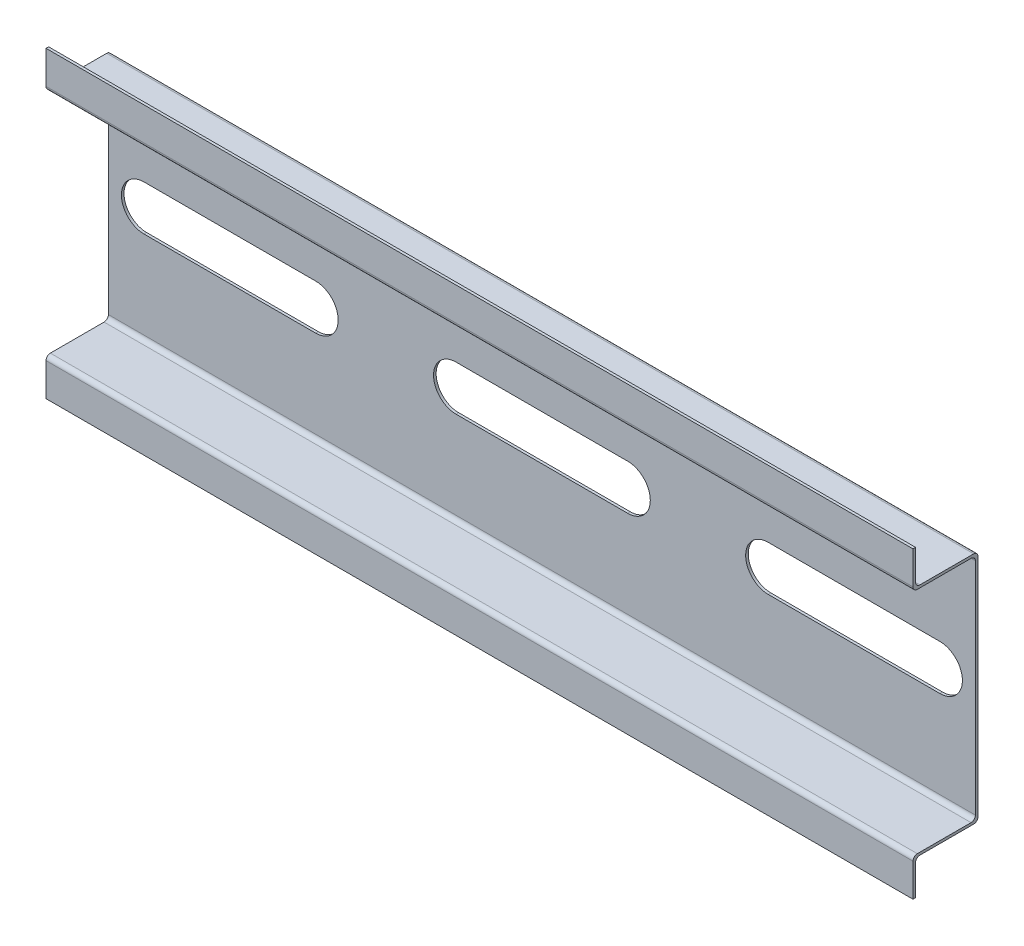
from build123d import *

# Parameters (mm, degrees)
AUFSATZ_LINEAR_AUSTRAGEN1_DEPTH = 100
SCHNITT_LINEAR_AUSTRAGEN1_DEPTH = 102.796365358


with BuildPart() as part:
    # Skizze1 → Aufsatz-Linear austragen1 (new body)
    with BuildSketch(Plane(origin=(0, 0, 0), x_dir=(0, 0, -1), z_dir=(1, 0, 0))):
        with BuildLine():
            Line((-3.75, 17.5), (-3.75, 13.7))
            ThreePointArc((-3.75, 13.7), (-3.603553391, 13.346446609), (-3.25, 13.2))
            Line((-3.25, 13.2), (2.95, 13.2))
            ThreePointArc((2.95, 13.2), (3.303553391, 13.053553391), (3.45, 12.7))
            Line((3.45, 12.7), (3.45, -12.7))
            ThreePointArc((3.45, -12.7), (3.303553391, -13.053553391), (2.95, -13.2))
            Line((2.95, -13.2), (-3.25, -13.2))
            ThreePointArc((-3.25, -13.2), (-3.603553391, -13.346446609), (-3.75, -13.7))
            Line((-3.75, -13.7), (-3.75, -17.5))
            Line((-3.75, -17.5), (-3.45, -17.5))
            Line((-3.45, -17.5), (-3.45, -14))
            ThreePointArc((-3.45, -14), (-3.303553391, -13.646446609), (-2.95, -13.5))
            Line((-2.95, -13.5), (3.25, -13.5))
            ThreePointArc((3.25, -13.5), (3.603553391, -13.353553391), (3.75, -13))
            Line((3.75, -13), (3.75, 13))
            ThreePointArc((3.75, 13), (3.603553391, 13.353553391), (3.25, 13.5))
            Line((3.25, 13.5), (-2.95, 13.5))
            ThreePointArc((-2.95, 13.5), (-3.303553391, 13.646446609), (-3.45, 14))
            Line((-3.45, 14), (-3.45, 17.5))
            Line((-3.45, 17.5), (-3.75, 17.5))
        make_face()
    extrude(amount=AUFSATZ_LINEAR_AUSTRAGEN1_DEPTH)

    # Skizze2 → Schnitt-Linear austragen1 (cut, through all)
    with BuildSketch(Plane(origin=(0, 0, -3.75), x_dir=(-1, 0, 0), z_dir=(0, 0, -1))):
        with BuildLine():
            Line((-95.9, 2.6), (-76.1, 2.6))
            ThreePointArc((-76.1, 2.6), (-73.5, 0), (-76.1, -2.6))
            Line((-76.1, -2.6), (-95.9, -2.6))
            ThreePointArc((-95.9, -2.6), (-98.5, 0), (-95.9, 2.6))
        make_face()
        with BuildLine():
            Line((-59.9, 2.6), (-40.1, 2.6))
            ThreePointArc((-40.1, 2.6), (-37.5, 0), (-40.1, -2.6))
            Line((-40.1, -2.6), (-59.9, -2.6))
            ThreePointArc((-59.9, -2.6), (-62.5, 0), (-59.9, 2.6))
        make_face()
        with BuildLine():
            Line((-23.9, 2.6), (-4.1, 2.6))
            ThreePointArc((-4.1, 2.6), (-1.5, 0), (-4.1, -2.6))
            Line((-4.1, -2.6), (-23.9, -2.6))
            ThreePointArc((-23.9, -2.6), (-26.5, 0), (-23.9, 2.6))
        make_face()
    extrude(amount=-SCHNITT_LINEAR_AUSTRAGEN1_DEPTH, mode=Mode.SUBTRACT)


solid = part.part
